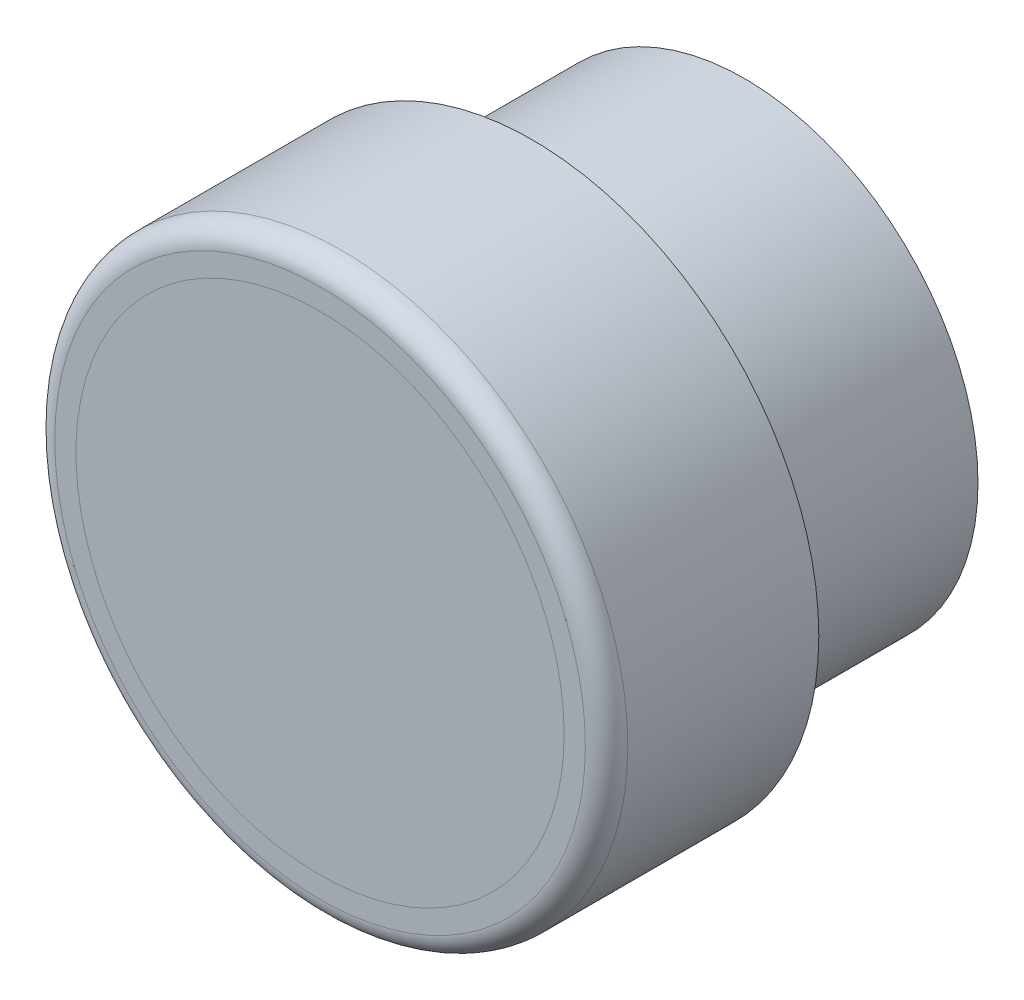
from build123d import *

# Parameters (mm, degrees)
SKETCH1_R           = 11
BOSS_EXTRUDE1_DEPTH = 10
SKETCH2_R           = 13.5
BOSS_EXTRUDE2_DEPTH = 10
FILLET1_R           = 1


with BuildPart() as part:
    # Sketch1 → Boss-Extrude1 (new body)
    with BuildSketch(Plane.XY):
        Circle(SKETCH1_R)
    extrude(amount=BOSS_EXTRUDE1_DEPTH)

    # Sketch2 → Boss-Extrude2 (add)
    with BuildSketch(Plane.XY.offset(10)):
        Circle(SKETCH2_R)
    extrude(amount=BOSS_EXTRUDE2_DEPTH)

    # Fillet1
    fillet1_edges = [part.edges().sort_by_distance(p)[0] for p in [
        (-13.5, 0, 20),
    ]]
    fillet(fillet1_edges, radius=FILLET1_R)


solid = part.part
